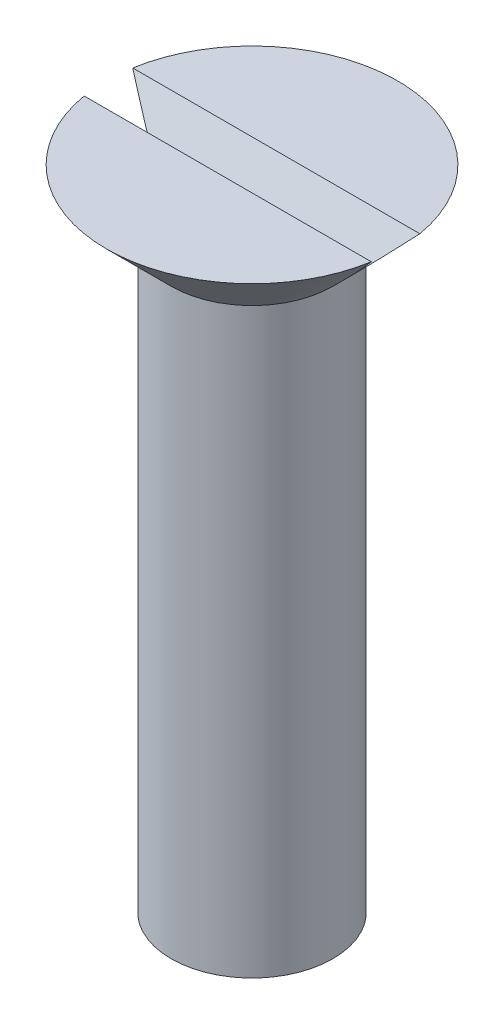
from build123d import *

# Parameters (mm, degrees)
EXTRUDE1_DEPTH = 5


with BuildPart() as part:
    # Sketch1 → Revolve1 (revolve)
    with BuildSketch(Plane.XY, mode=Mode.PRIVATE) as revolve1_sk:
        Polygon((0, 35.11626506), (4.5, 35.11626506), (2.5, 33.11626506), (2.5, 15.11626506), (0, 15.11626506), align=None)
    revolve(revolve1_sk.sketch.rotate(Axis((0, 45.521084337, 0), (0, -1, 0)), 90), axis=Axis((0, 45.521084337, 0), (0, -1, 0)))

    # Sketch2 → Extrude1 (cut, symmetric)
    with BuildSketch(Plane(origin=(0, 0, 0), x_dir=(0, 0, -1), z_dir=(1, 0, 0))):
        Polygon((-0.75, 35.11626506), (0, 33.61626506), (0.75, 35.11626506), align=None)
    extrude(amount=EXTRUDE1_DEPTH, both=True, mode=Mode.SUBTRACT)


solid = part.part
